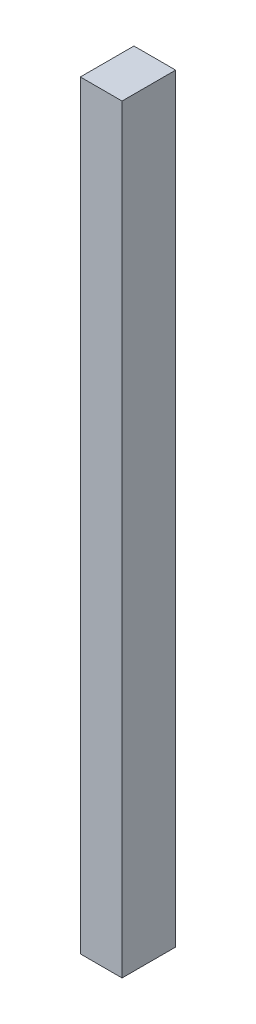
from build123d import *

# Parameters (mm, degrees)
SKETCH1_W           = 38.45
SKETCH1_H           = 49.4
BOSS_EXTRUDE1_DEPTH = 700


with BuildPart() as part:
    # Sketch1 → Boss-Extrude1 (new body)
    with BuildSketch(Plane(origin=(0, 0, 0), x_dir=(1, 0, 0), z_dir=(0, 1, 0))):
        with Locations((19.225, -24.7)):
            Rectangle(SKETCH1_W, SKETCH1_H)
    extrude(amount=BOSS_EXTRUDE1_DEPTH)


solid = part.part
